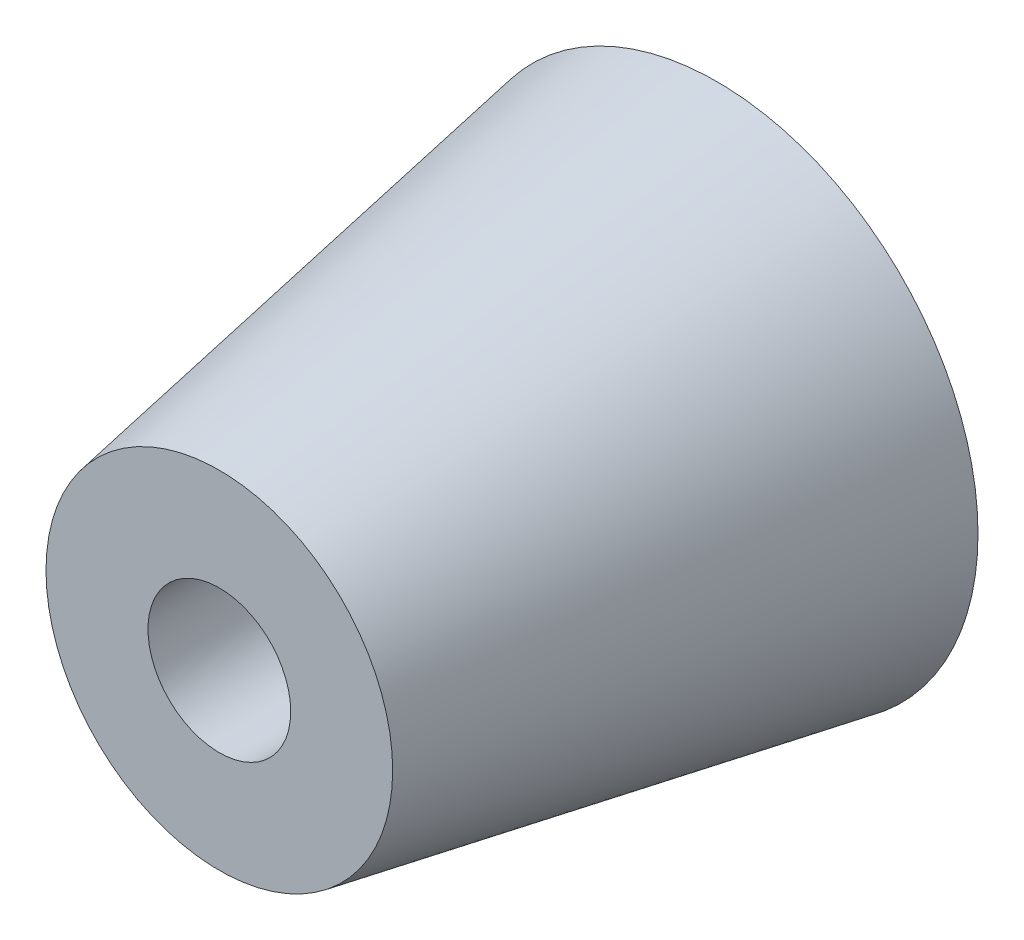
from build123d import *


with BuildPart() as part:
    # Sketch1 → Revolve1 (revolve)
    with BuildSketch(Plane(origin=(0, 0, 0), x_dir=(0, 0, -1), z_dir=(1, 0, 0)), mode=Mode.PRIVATE) as revolve1_sk:
        Polygon((-33.715360463, 3.5), (-28.715360463, 3.5), (-9.315360463, 7.258092539), (-9.315360463, 12.802378329), (-33.715360463, 8.5), align=None)
    revolve(revolve1_sk.sketch.rotate(Axis((0, 0, 51.495497957), (0, 0, -1)), 90), axis=Axis((0, 0, 51.495497957), (0, 0, -1)))


solid = part.part
